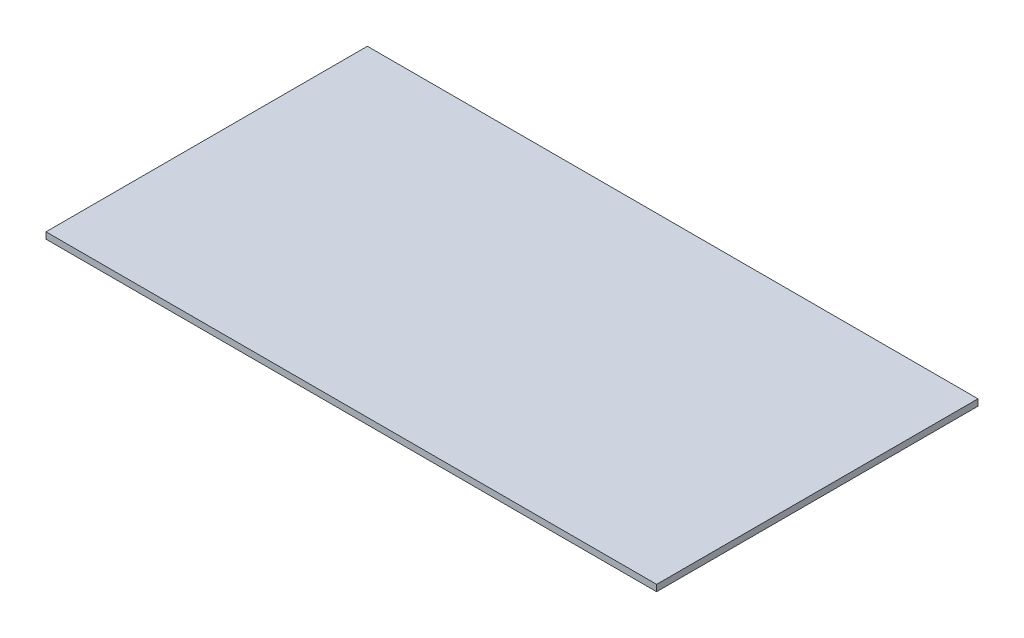
from build123d import *

# Parameters (mm, degrees)
SKETCH1_W           = 241.3
SKETCH1_H           = 127
BOSS_EXTRUDE1_DEPTH = 2.54


with BuildPart() as part:
    # Sketch1 → Boss-Extrude1 (new body)
    with BuildSketch(Plane(origin=(0, 0, 0), x_dir=(1, 0, 0), z_dir=(0, 1, 0))):
        with Locations((120.65, 63.5)):
            Rectangle(SKETCH1_W, SKETCH1_H)
    extrude(amount=BOSS_EXTRUDE1_DEPTH)


solid = part.part
